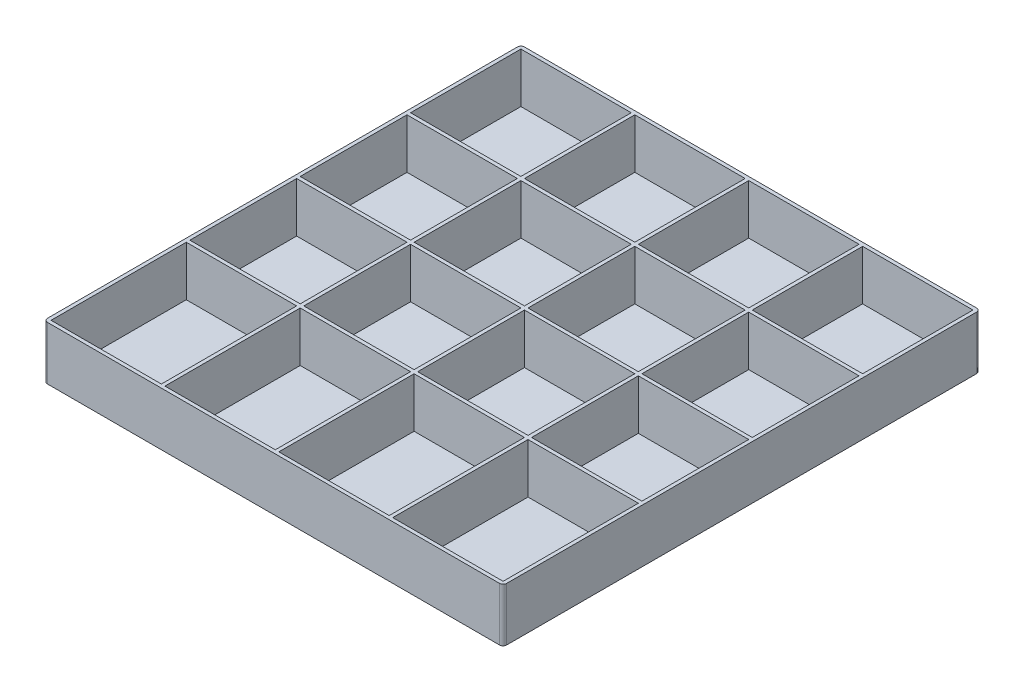
from build123d import *

# Parameters (mm, degrees)
SKETCH_1_W             = 258
SKETCH_1_H             = 268
EXTRUDE_1_DEPTH        = 2
SKETCH_2_W             = 258
SKETCH_2_H             = 268
SKETCH_2_W_2           = 254
SKETCH_2_H_2           = 264
EXTRUDE_2_DEPTH        = 28
SKETCH_3_W             = 2
SKETCH_3_H             = 264
EXTRUDE_3_DEPTH        = 28
PATTERN_LINEAR_1_COUNT = 3
PATTERN_LINEAR_1_PITCH = 64
SKETCH_4_W             = 254
SKETCH_4_H             = 2
EXTRUDE_5_DEPTH        = 28
PATTERN_LINEAR_2_COUNT = 3
PATTERN_LINEAR_2_PITCH = 62
FILLET_1_R             = 2


with BuildPart() as part:
    # 草图1 → 凸台-拉伸1 (new body)
    with BuildSketch(Plane(origin=(0, 0, 0), x_dir=(1, 0, 0), z_dir=(0, 1, 0))):
        Rectangle(SKETCH_1_W, SKETCH_1_H)
    extrude(amount=EXTRUDE_1_DEPTH)

    # 草图2 → 凸台-拉伸2 (add)
    with BuildSketch(Plane(origin=(0, 2, 0), x_dir=(1, 0, 0), z_dir=(0, 1, 0))):
        Rectangle(SKETCH_2_W, SKETCH_2_H)
        Rectangle(SKETCH_2_W_2, SKETCH_2_H_2, mode=Mode.SUBTRACT)
    extrude(amount=EXTRUDE_2_DEPTH)

    # 草图3 → 凸台-拉伸3 (add)
    with BuildSketch(Plane(origin=(0, 2, 0), x_dir=(1, 0, 0), z_dir=(0, 1, 0))):
        with Locations((-64, 0)):
            Rectangle(SKETCH_3_W, SKETCH_3_H)
    extrude_3 = extrude(amount=EXTRUDE_3_DEPTH)

    # 阵列(线性)1: 凸台-拉伸3 ×3
    with Locations(*[(i * PATTERN_LINEAR_1_PITCH, 0, 0) for i in range(1, PATTERN_LINEAR_1_COUNT)]):
        add(extrude_3)

    # 草图4 → 凸台-拉伸5 (add)
    with BuildSketch(Plane(origin=(0, 2, 0), x_dir=(1, 0, 0), z_dir=(0, 1, 0))):
        with Locations((0, 69)):
            Rectangle(SKETCH_4_W, SKETCH_4_H)
    extrude_5 = extrude(amount=EXTRUDE_5_DEPTH)

    # 阵列(线性)2: 凸台-拉伸5 ×3
    with Locations(*[(0, 0, i * PATTERN_LINEAR_2_PITCH) for i in range(1, PATTERN_LINEAR_2_COUNT)]):
        add(extrude_5)

    # 圆角1
    fillet_1_edges = [part.edges().sort_by_distance(p)[0] for p in [
        (-129, 15, -134),
        (129, 15, -134),
        (129, 15, 134),
        (-129, 15, 134),
    ]]
    fillet(fillet_1_edges, radius=FILLET_1_R)


solid = part.part
